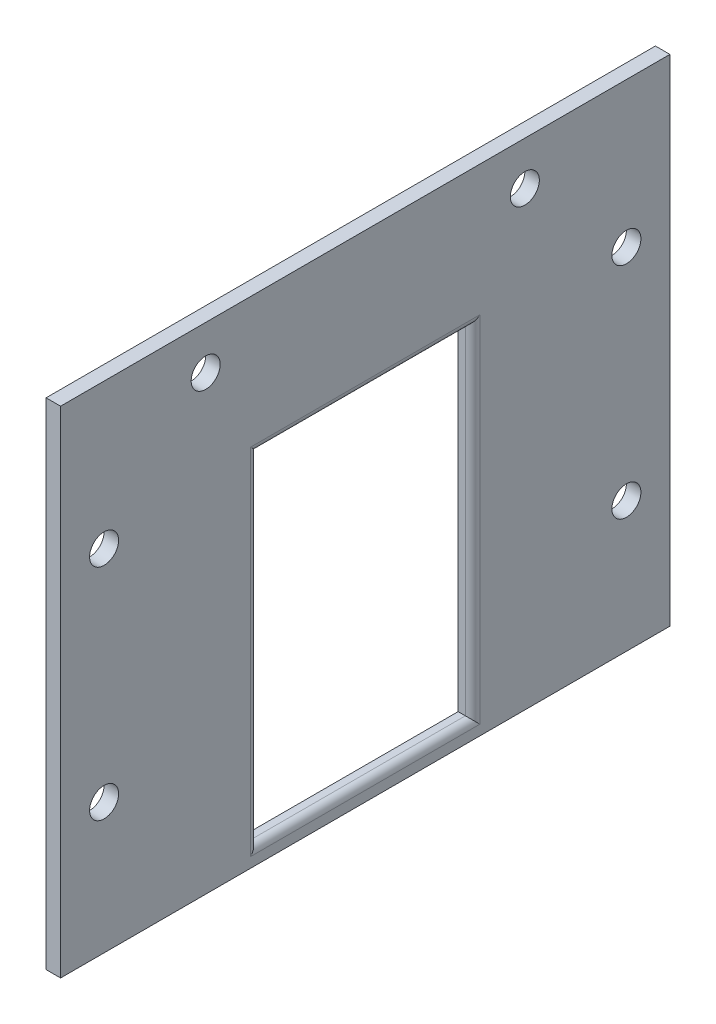
from build123d import *

# Parameters (mm, degrees)
SKETCH1_W           = 127
SKETCH1_H           = 177.8
BOSS_EXTRUDE1_DEPTH = 3.175
SKETCH7_W           = 127
SKETCH7_H           = 69.425000088
CUT_EXTRUDE5_DEPTH  = 110.295656936
SKETCH8_W           = 3.175
SKETCH8_H           = 108.374999912
BOSS_EXTRUDE2_DEPTH = 3.175
SKETCH9_W           = 46.99
SKETCH9_H           = 74.422
CUT_EXTRUDE6_DEPTH  = 112.17034789
FILLET1_R           = 1.5875
SKETCH10_R          = 3.175
CUT_EXTRUDE7_DEPTH  = 112.17034789


with BuildPart() as part:
    # Sketch1 → Boss-Extrude1 (new body)
    with BuildSketch(Plane(origin=(0, 0, 0), x_dir=(0, 0, -1), z_dir=(1, 0, 0))):
        Rectangle(SKETCH1_W, SKETCH1_H)
    extrude(amount=-BOSS_EXTRUDE1_DEPTH)

    # Sketch7 → Cut-Extrude5 (cut, through all)
    with BuildSketch(Plane(origin=(0, 0, 0), x_dir=(0, 0, -1), z_dir=(1, 0, 0))):
        with Locations((0, 54.187499956)):
            Rectangle(SKETCH7_W, SKETCH7_H)
    extrude(amount=-CUT_EXTRUDE5_DEPTH, mode=Mode.SUBTRACT)

    # Sketch8 → Boss-Extrude2 (add)
    with BuildSketch(Plane(origin=(0, 0, 0), x_dir=(0, 0, -1), z_dir=(1, 0, 0))):
        with Locations((-65.0875, -34.712500044)):
            Rectangle(SKETCH8_W, SKETCH8_H)
        with Locations((65.0875, -34.712500044)):
            Rectangle(SKETCH8_W, SKETCH8_H)
    extrude(amount=-BOSS_EXTRUDE2_DEPTH)

    # Sketch9 → Cut-Extrude6 (cut, through all)
    with BuildSketch(Plane(origin=(0, 0, 0), x_dir=(0, 0, -1), z_dir=(1, 0, 0))):
        with Locations((0, -47.879)):
            Rectangle(SKETCH9_W, SKETCH9_H)
    extrude(amount=-CUT_EXTRUDE6_DEPTH, mode=Mode.SUBTRACT)

    # Fillet1
    fillet1_edges = [part.edges().sort_by_distance(p)[0] for p in [
        (0, -10.668, 0),
        (0, -85.09, 0),
        (0, -47.879, 23.495),
        (0, -47.879, -23.495),
    ]]
    fillet(fillet1_edges, radius=FILLET1_R)

    # Sketch10 → Cut-Extrude7 (cut, through all)
    with BuildSketch(Plane(origin=(0, 0, 0), x_dir=(0, 0, -1), z_dir=(1, 0, 0))):
        with Locations((-57.15, -60.325)):
            Circle(SKETCH10_R)
        with Locations((-57.15, -12.275000088)):
            Circle(SKETCH10_R)
        with Locations((-34.925, 9.949999912)):
            Circle(SKETCH10_R)
        with Locations(Location((34.925, 9.949999912, 0), (0, 0, 180))):
            Circle(SKETCH10_R)
        with Locations(Location((57.15, -12.275000088, 0), (0, 0, 180))):
            Circle(SKETCH10_R)
        with Locations(Location((57.15, -60.325, 0), (0, 0, 180))):
            Circle(SKETCH10_R)
    extrude(amount=-CUT_EXTRUDE7_DEPTH, mode=Mode.SUBTRACT)


solid = part.part
